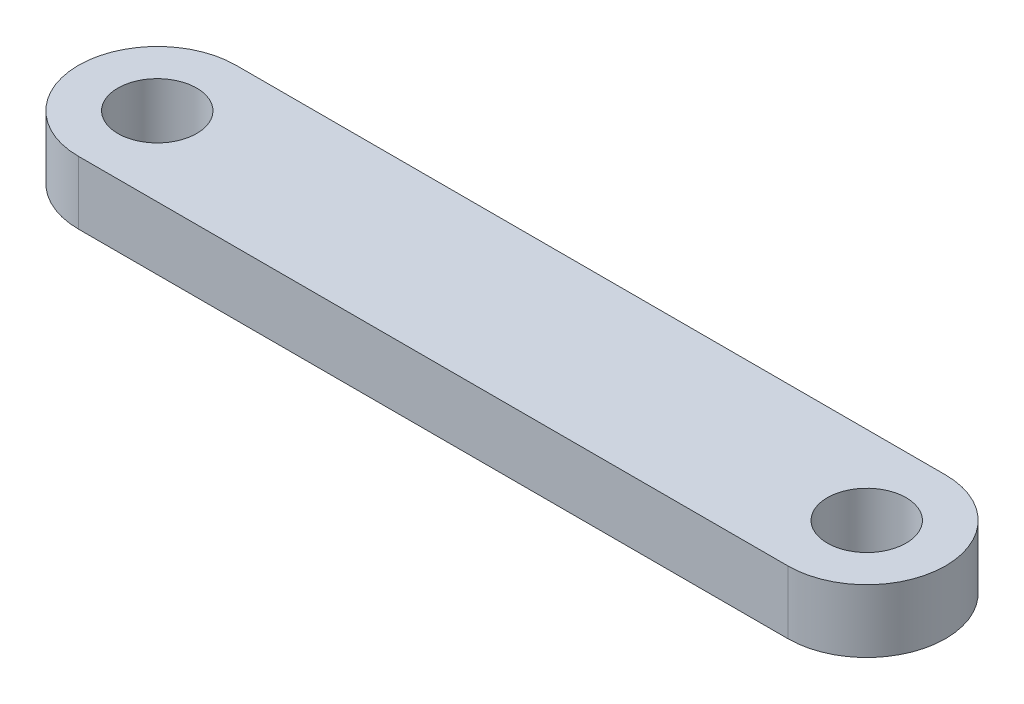
from build123d import *

# Parameters (mm, degrees)
SKETCH1_R           = 2.5
BOSS_EXTRUDE1_DEPTH = 4


with BuildPart() as part:
    # Sketch1 → Boss-Extrude1 (new body)
    with BuildSketch(Plane(origin=(0, 0, 0), x_dir=(1, 0, 0), z_dir=(0, 1, 0))):
        with BuildLine():
            Line((0, -5), (-45, -5))
            ThreePointArc((-45, -5), (-50, 0), (-45, 5))
            Line((-45, 5), (0, 5))
            ThreePointArc((0, 5), (5, 0), (0, -5))
        make_face()
        with Locations(Location((-45, 0, 0), (0, 0, 270))):
            Circle(SKETCH1_R, mode=Mode.SUBTRACT)
        with Locations(Location((0, 0, 0), (0, 0, 90))):
            Circle(SKETCH1_R, mode=Mode.SUBTRACT)
    extrude(amount=BOSS_EXTRUDE1_DEPTH)


solid = part.part
